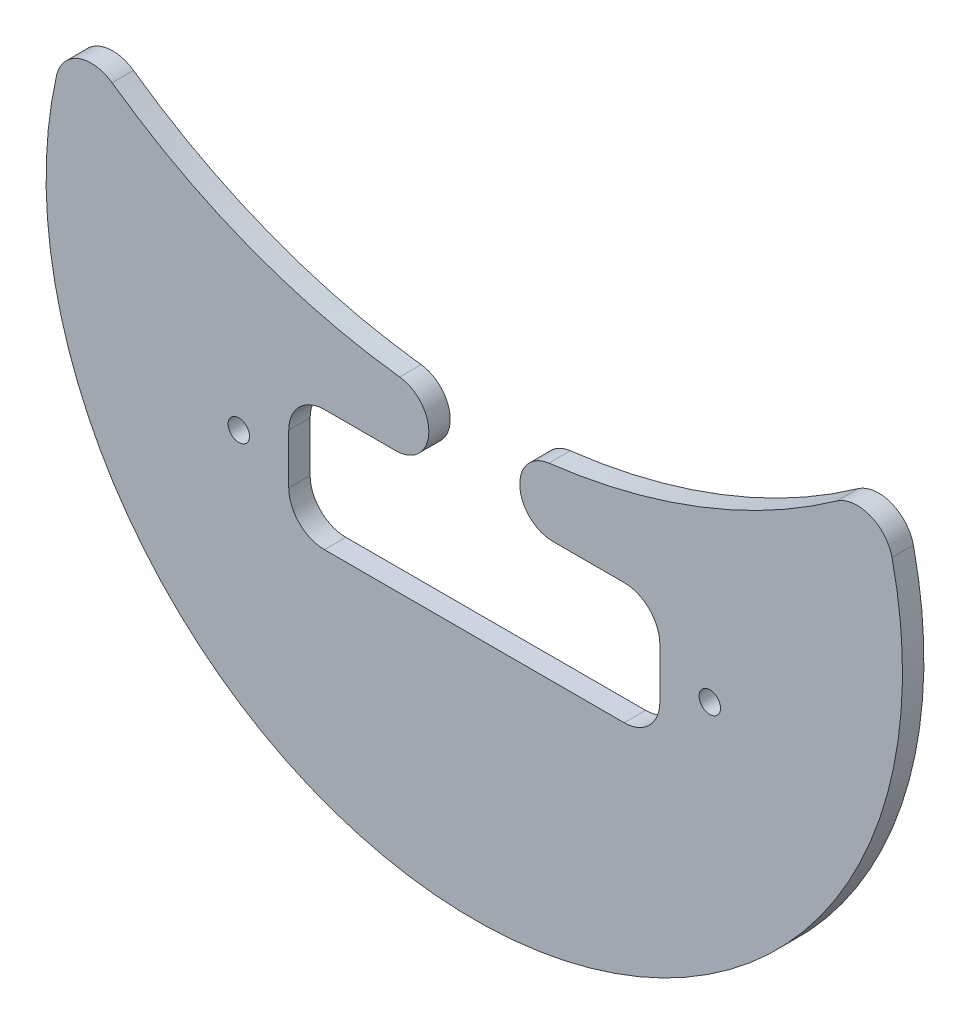
from build123d import *

# Parameters (mm, degrees)
SKETCH1_R           = 1.5
BOSS_EXTRUDE1_DEPTH = 3
FILLET4_R           = 5


with BuildPart() as part:
    # Sketch1 → Boss-Extrude1 (new body)
    with BuildSketch(Plane.XY):
        with BuildLine():
            Line((-25.848592033, 6.75), (26.151407967, 6.75))
            Line((26.151407967, 6.75), (26.151407967, 23.75))
            Line((26.151407967, 23.75), (11.151407967, 23.75))
            ThreePointArc((11.151407967, 23.75), (6.530900978, 28.102570311), (10.600025023, 32.974549649))
            ThreePointArc((10.600025023, 32.974549649), (35.015964593, 39.57666935), (56.532965215, 52.8712086))
            ThreePointArc((56.532965215, 52.8712086), (0.151407967, -27.65), (-56.23014928, 52.8712086))
            ThreePointArc((-56.23014928, 52.8712086), (-34.713148658, 39.57666935), (-10.297209088, 32.974549649))
            ThreePointArc((-10.297209088, 32.974549649), (-6.228085043, 28.102570311), (-10.848592033, 23.75))
            Line((-10.848592033, 23.75), (-25.848592033, 23.75))
            Line((-25.848592033, 23.75), (-25.848592033, 6.75))
        make_face()
        with Locations((-32.848592033, 15.25)):
            Circle(SKETCH1_R, mode=Mode.SUBTRACT)
        with Locations((33.151407967, 15.25)):
            Circle(SKETCH1_R, mode=Mode.SUBTRACT)
    extrude(amount=BOSS_EXTRUDE1_DEPTH)

    # Fillet4
    fillet4_edges = [part.edges().sort_by_distance(p)[0] for p in [
        (-25.848592033, 23.75, 1.5),
        (-25.848592033, 6.75, 1.5),
        (26.151407967, 6.75, 1.5),
        (26.151407967, 23.75, 1.5),
        (56.532965215, 52.8712086, 1.5),
        (-56.23014928, 52.8712086, 1.5),
    ]]
    fillet(fillet4_edges, radius=FILLET4_R)


solid = part.part
